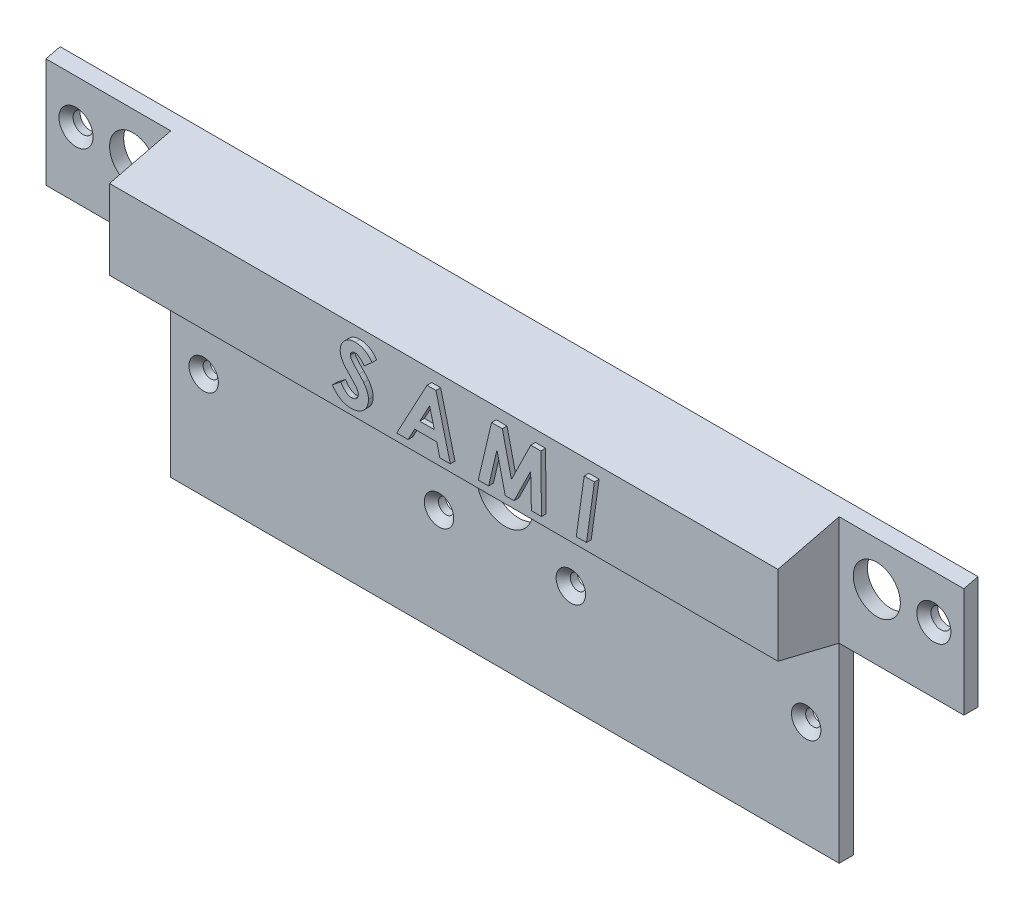
from build123d import *

# Parameters (mm, degrees)
CROQUIS1_R                 = 2.125
CROQUIS1_R_2               = 1.625
SALIENTE_EXTRUIR1_DEPTH    = 3
CROQUIS2_W                 = 142
CROQUIS2_H                 = 24
SALIENTE_EXTRUIR2_DEPTH    = 13
CORTAR_EXTRUIR1_START      = -4
CORTAR_EXTRUIR1_DEPTH      = 134
CORTAR_EXTRUIR2_DEPTH      = 182.852962582
CORTAR_EXTRUIR2_DEPTH_BACK = 182.852962582
SALIENTE_EXTRUIR3_DEPTH    = 1
CHAFL_N1_SIZE              = 1.5
CROQUIS7_R                 = 6
CORTAR_EXTRUIR3_DEPTH      = 10
CROQUIS11_R                = 5
CORTAR_EXTRUIR7_DEPTH      = 60


with BuildPart() as part:
    # Croquis1 → Saliente-Extruir1 (new body)
    with BuildSketch(Plane.XY):
        Polygon((-97.5, -2), (-97.5, -26), (-71, -26), (-71, -66.5), (71, -66.5), (71, -26), (97.5, -26), (97.5, -2), align=None)
        with Locations((-91.125, -12.1)):
            Circle(CROQUIS1_R, mode=Mode.SUBTRACT)
        with Locations((-64, -44)):
            Circle(CROQUIS1_R_2, mode=Mode.SUBTRACT)
        with Locations((-14, -44)):
            Circle(CROQUIS1_R_2, mode=Mode.SUBTRACT)
        with Locations(Location((14, -44, 0), (0, 0, 180))):
            Circle(CROQUIS1_R_2, mode=Mode.SUBTRACT)
        with Locations(Location((64, -44, 0), (0, 0, 180))):
            Circle(CROQUIS1_R_2, mode=Mode.SUBTRACT)
        with Locations(Location((91.125, -12.1, 0), (0, 0, 180))):
            Circle(CROQUIS1_R, mode=Mode.SUBTRACT)
    extrude(amount=SALIENTE_EXTRUIR1_DEPTH)

    # Croquis2 → Saliente-Extruir2 (add)
    with BuildSketch(Plane.XY.offset(3)):
        with Locations((0, -14)):
            Rectangle(CROQUIS2_W, CROQUIS2_H)
    extrude(amount=SALIENTE_EXTRUIR2_DEPTH)

    # Croquis4 → Cortar-Extruir1 (cut)
    with BuildSketch(Plane.ZY.offset(71).offset(CORTAR_EXTRUIR1_START)):
        Polygon((0, -23), (12.254442441, -20), (12.254442441, -8), (0, -5), align=None)
    extrude(amount=-CORTAR_EXTRUIR1_DEPTH, mode=Mode.SUBTRACT)

    # Croquis5 → Cortar-Extruir2 (cut, two sides: drawn at the far end of the back side and taken through both)
    with BuildSketch(Plane.ZY.offset(71).offset(-CORTAR_EXTRUIR2_DEPTH_BACK)):
        Polygon((3, -26), (16, -22.817480666), (16, -5.916946873), (0, -2), (13.126652557, 3.411104472), (22.490929508, -3.111277484), (22.490929508, -28.482984682), align=None)
    extrude(amount=CORTAR_EXTRUIR2_DEPTH + CORTAR_EXTRUIR2_DEPTH_BACK, mode=Mode.SUBTRACT)

    # Croquis6 → Saliente-Extruir3 (add)
    # profile 1 of 4: a face of its own
    with BuildSketch(Plane.XY.offset(16)):
        with BuildLine():
            Line((-14.237980769, -9.985749897), (-15.90625, -11.44007682))
            add(Edge.make_bspline(
                [(-15.90625, -11.44007682), (-15.989626138, -11.327448514), (-16.149414971, -11.111598441), (-16.40296706, -10.822085331), (-16.645879271, -10.570501926), (-16.890561991, -10.369874968), (-17.129057977, -10.210789404), (-17.363445534, -10.095551079), (-17.595042177, -10.022729498), (-17.749526692, -10.014017491), (-17.824519231, -10.009788358)],
                knots=[0, 0, 0, 0, 1.358515141, 2.603569235, 3.730126198, 4.746094498, 5.666493297, 6.504166865, 7.273866877, 8, 8, 8, 8], degree=3))
            add(Edge.make_bspline(
                [(-17.824519231, -10.009788358), (-17.895356089, -10.012855098), (-18.031584807, -10.018752848), (-18.22713207, -10.069034852), (-18.404858991, -10.149916554), (-18.557444672, -10.266921908), (-18.684884048, -10.401824243), (-18.779509513, -10.553209832), (-18.834618158, -10.720070113), (-18.842257012, -10.835512647), (-18.846153846, -10.894403743)],
                knots=[0, 0, 0, 0, 1.130304997, 2.173727141, 3.204821236, 4.229135679, 5.225705988, 6.15679035, 7.05971714, 8, 8, 8, 8], degree=3))
            add(Edge.make_bspline(
                [(-18.846153846, -10.894403743), (-18.842604913, -10.952419762), (-18.835140436, -11.074444962), (-18.780451752, -11.259433313), (-18.697727885, -11.454346792), (-18.598228785, -11.623824314), (-18.486512728, -11.77771519), (-18.369441299, -11.928296257), (-18.21657709, -12.108334434), (-18.030567158, -12.319891013), (-17.813188546, -12.564750981), (-17.558803159, -12.839351591), (-17.271991311, -13.145496303), (-17.068274685, -13.359303629), (-16.961538462, -13.47132682)],
                knots=[0, 0, 0, 0, 0.642317819, 1.35098826, 2.122816345, 2.986294386, 3.520967692, 4.229638134, 5.099348126, 6.137609051, 7.351336444, 8.727500291, 10.285391505, 12, 12, 12, 12], degree=3))
            add(Edge.make_bspline(
                [(-16.961538462, -13.47132682), (-16.903636795, -13.531223219), (-16.792534747, -13.646152772), (-16.636643855, -13.814003622), (-16.497508029, -13.969569485), (-16.369045391, -14.107401891), (-16.259073151, -14.234617568), (-16.165177608, -14.34816442), (-16.085465961, -14.446444683), (-16.0383396, -14.508090166), (-16.016826923, -14.536230666)],
                knots=[0, 0, 0, 0, 1.403722598, 2.693470914, 3.859630393, 4.920438112, 5.867965235, 6.69256451, 7.40316977, 8, 8, 8, 8], degree=3))
            add(Edge.make_bspline(
                [(-16.016826923, -14.536230666), (-15.931162119, -14.654577639), (-15.765940249, -14.88283367), (-15.551635213, -15.229880041), (-15.37438103, -15.564252574), (-15.235094927, -15.88990853), (-15.130899714, -16.210409792), (-15.05543423, -16.531054248), (-15.007896968, -16.854509011), (-15.002624572, -17.072130546), (-15, -17.180461435)],
                knots=[0, 0, 0, 0, 1.215130546, 2.343624586, 3.390252636, 4.360992906, 5.286454858, 6.190345157, 7.099163061, 8, 8, 8, 8], degree=3))
            add(Edge.make_bspline(
                [(-15, -17.180461435), (-15.003265975, -17.300028306), (-15.009693432, -17.535336508), (-15.059498325, -17.880577858), (-15.137073288, -18.211608952), (-15.252749328, -18.52644101), (-15.395580999, -18.828499955), (-15.576864744, -19.11336264), (-15.785408375, -19.385848928), (-16.026160027, -19.639521442), (-16.289666574, -19.871503798), (-16.576596067, -20.072392787), (-16.879880295, -20.243624017), (-17.202602308, -20.384593326), (-17.543778684, -20.491812043), (-17.90280078, -20.568073199), (-18.279005837, -20.61869508), (-18.536688597, -20.622983286), (-18.668269231, -20.625172973)],
                knots=[0, 0, 0, 0, 1.018989505, 2.005376454, 2.968035412, 3.912365187, 4.859556873, 5.811049809, 6.78527381, 7.780773345, 8.787785161, 9.773320145, 10.761314359, 11.752515283, 12.770107012, 13.804505292, 14.878913802, 16, 16, 16, 16], degree=3))
            add(Edge.make_bspline(
                [(-18.668269231, -20.625172973), (-18.769284127, -20.62314894), (-18.969252502, -20.619142179), (-19.265642237, -20.592539289), (-19.554845581, -20.547124694), (-19.836437535, -20.481588061), (-20.111006069, -20.399756263), (-20.378979241, -20.301531223), (-20.639686545, -20.182641261), (-20.893461855, -20.046177875), (-21.140328633, -19.891607359), (-21.378805584, -19.717085991), (-21.611465717, -19.525979253), (-21.835259605, -19.314667737), (-22.054912323, -19.088984376), (-22.266576688, -18.843795132), (-22.468125847, -18.578072355), (-22.596069502, -18.392506783), (-22.661057692, -18.298249897)],
                knots=[0, 0, 0, 0, 1.003438088, 1.986398949, 2.953471805, 3.909242729, 4.856156023, 5.798037682, 6.742035895, 7.700024963, 8.658509928, 9.632892881, 10.633707184, 11.647385023, 12.688779161, 13.761077638, 14.862753205, 16, 16, 16, 16], degree=3))
            Line((-22.661057692, -18.298249897), (-20.884615385, -16.901615281))
            add(Edge.make_bspline(
                [(-20.884615385, -16.901615281), (-20.796133427, -17.037667664), (-20.626430657, -17.298607485), (-20.34982297, -17.650830005), (-20.067822589, -17.950179859), (-19.779405576, -18.195493135), (-19.483644037, -18.386365741), (-19.182661042, -18.522803011), (-18.875117063, -18.610559253), (-18.666427793, -18.620314724), (-18.5625, -18.625172973)],
                knots=[0, 0, 0, 0, 1.289844872, 2.473840458, 3.555310637, 4.554525788, 5.477014656, 6.343795492, 7.175205895, 8, 8, 8, 8], degree=3))
            add(Edge.make_bspline(
                [(-18.5625, -18.625172973), (-18.466608696, -18.620970508), (-18.279938128, -18.612789613), (-18.012906753, -18.536619842), (-17.767915589, -18.419199206), (-17.555817127, -18.251540983), (-17.377139034, -18.054637597), (-17.24725602, -17.83032248), (-17.169063266, -17.584546429), (-17.158994702, -17.414201651), (-17.153846154, -17.32709605)],
                knots=[0, 0, 0, 0, 1.07813582, 2.098795369, 3.104167493, 4.120866408, 5.124778177, 6.083335831, 7.019916046, 8, 8, 8, 8], degree=3))
            add(Edge.make_bspline(
                [(-17.153846154, -17.32709605), (-17.156305742, -17.256296592), (-17.161308997, -17.11227744), (-17.213463163, -16.897776687), (-17.290868572, -16.680273894), (-17.384686199, -16.496451163), (-17.485874595, -16.335262812), (-17.593034102, -16.189295342), (-17.727871488, -16.01796368), (-17.894684288, -15.825289294), (-18.086653682, -15.6047675), (-18.311053405, -15.364148452), (-18.560713769, -15.095469359), (-18.739972106, -14.911640288), (-18.834134615, -14.81507682)],
                knots=[0, 0, 0, 0, 0.82235112, 1.672813781, 2.554588539, 3.50524042, 4.06657461, 4.767804758, 5.610876414, 6.602916144, 7.732569792, 9.01260869, 10.430754915, 12, 12, 12, 12], degree=3))
            add(Edge.make_bspline(
                [(-18.834134615, -14.81507682), (-18.933796083, -14.712000384), (-19.126457636, -14.512737151), (-19.399022138, -14.221116735), (-19.644537968, -13.949692255), (-19.862727128, -13.698178106), (-20.053769849, -13.466122167), (-20.220971836, -13.255284863), (-20.359272385, -13.062884941), (-20.43727304, -12.93805128), (-20.473557692, -12.879980666)],
                knots=[0, 0, 0, 0, 1.354401886, 2.618275412, 3.770529779, 4.811580489, 5.763301005, 6.60974666, 7.35327647, 8, 8, 8, 8], degree=3))
            add(Edge.make_bspline(
                [(-20.473557692, -12.879980666), (-20.554574406, -12.735277508), (-20.711760817, -12.454528401), (-20.873808353, -12.012655576), (-20.979408373, -11.576459651), (-20.993212918, -11.285199559), (-21, -11.141999897)],
                knots=[0, 0, 0, 0, 1.081804801, 2.098888081, 3.065307629, 4, 4, 4, 4], degree=3))
            add(Edge.make_bspline(
                [(-21, -11.141999897), (-20.997562984, -11.049741664), (-20.992715305, -10.866222803), (-20.957815751, -10.595373109), (-20.904379157, -10.330523561), (-20.819192416, -10.075691466), (-20.720947532, -9.824495817), (-20.592529271, -9.583537033), (-20.448250884, -9.34633255), (-20.332500788, -9.199389859), (-20.274038462, -9.125172973)],
                knots=[0, 0, 0, 0, 1.012167245, 2.013389743, 2.992947912, 3.971795425, 4.958040075, 5.949133471, 6.964161297, 8, 8, 8, 8], degree=3))
            add(Edge.make_bspline(
                [(-20.274038462, -9.125172973), (-20.196863127, -9.035727326), (-20.044645553, -8.859308275), (-19.781280254, -8.633794587), (-19.502039805, -8.439002065), (-19.200913405, -8.282622933), (-18.881363751, -8.157986947), (-18.54035169, -8.073413083), (-18.180490688, -8.018161336), (-17.933706603, -8.012618614), (-17.807692308, -8.009788358)],
                knots=[0, 0, 0, 0, 1.010152455, 1.992384693, 2.959065588, 3.919519142, 4.890305168, 5.888624478, 6.921877408, 8, 8, 8, 8], degree=3))
            add(Edge.make_bspline(
                [(-17.807692308, -8.009788358), (-17.633433825, -8.01587198), (-17.289683468, -8.027872813), (-16.783975681, -8.121148963), (-16.302065667, -8.279260008), (-15.839133772, -8.494079527), (-15.402696524, -8.776984417), (-14.986925157, -9.11896429), (-14.592049103, -9.522456693), (-14.358202489, -9.828441546), (-14.237980769, -9.985749897)],
                knots=[0, 0, 0, 0, 0.984438778, 1.941949542, 2.894274057, 3.844399604, 4.817935388, 5.825099055, 6.88187249, 8, 8, 8, 8], degree=3))
        make_face()
    # profile 2 of 4: a face of its own
    with BuildSketch(Plane.XY.offset(16)):
        Polygon((-2.550480769, -8.317480666), (-0.661057692, -8.317480666), (2.384615385, -20.317480666), (0.168269231, -20.317480666), (-0.495192308, -17.70209605), (-5.173076923, -17.70209605), (-6.576923077, -20.317480666), (-9, -20.317480666), align=None)
        Polygon((-1.007211538, -15.70209605), (-1.997596154, -11.79584605), (-4.096153846, -15.70209605), align=None, mode=Mode.SUBTRACT)
    # profile 3 of 4: a face of its own
    with BuildSketch(Plane.XY.offset(16)):
        Polygon((11.149038462, -8.317480666), (13.439903846, -8.317480666), (15.384615385, -16.678057589), (19.490384615, -8.317480666), (21.615384615, -8.317480666), (21.769230769, -20.317480666), (19.615384615, -20.317480666), (19.461538462, -13.13959605), (15.9375, -20.317480666), (14.060096154, -20.317480666), (12.307692308, -12.779019127), (10.536057692, -20.317480666), (8.329326923, -20.317480666), align=None)
    # profile 4 of 4: a face of its own
    with BuildSketch(Plane.XY.offset(16)):
        Polygon((30.836538462, -8.317480666), (33.009615385, -8.317480666), (31.326923077, -20.317480666), (29.153846154, -20.317480666), align=None)
    extrude(amount=SALIENTE_EXTRUIR3_DEPTH)

    # Chaflán1
    chafl_n1_edges = [part.edges().sort_by_distance(p)[0] for p in [
        (-93.25, -12.1, 3),
        (-65.625, -44, 3),
        (-15.625, -44, 3),
        (15.625, -44, 3),
        (65.625, -44, 3),
        (93.25, -12.1, 3),
    ]]
    chamfer(chafl_n1_edges, length=CHAFL_N1_SIZE)

    # Croquis7 → Cortar-Extruir3 (cut)
    with BuildSketch(Plane.XY.offset(3)):
        with Locations((0, -34)):
            Circle(CROQUIS7_R)
    extrude(amount=-CORTAR_EXTRUIR3_DEPTH, mode=Mode.SUBTRACT)

    # Croquis11 → Cortar-Extruir7 (cut)
    with BuildSketch(Plane.XY.offset(3)):
        with Locations((-79, -12.1)):
            Circle(CROQUIS11_R)
        with Locations(Location((79, -12.1, 0), (0, 0, 180))):
            Circle(CROQUIS11_R)
    extrude(amount=-CORTAR_EXTRUIR7_DEPTH, mode=Mode.SUBTRACT)


solid = part.part
